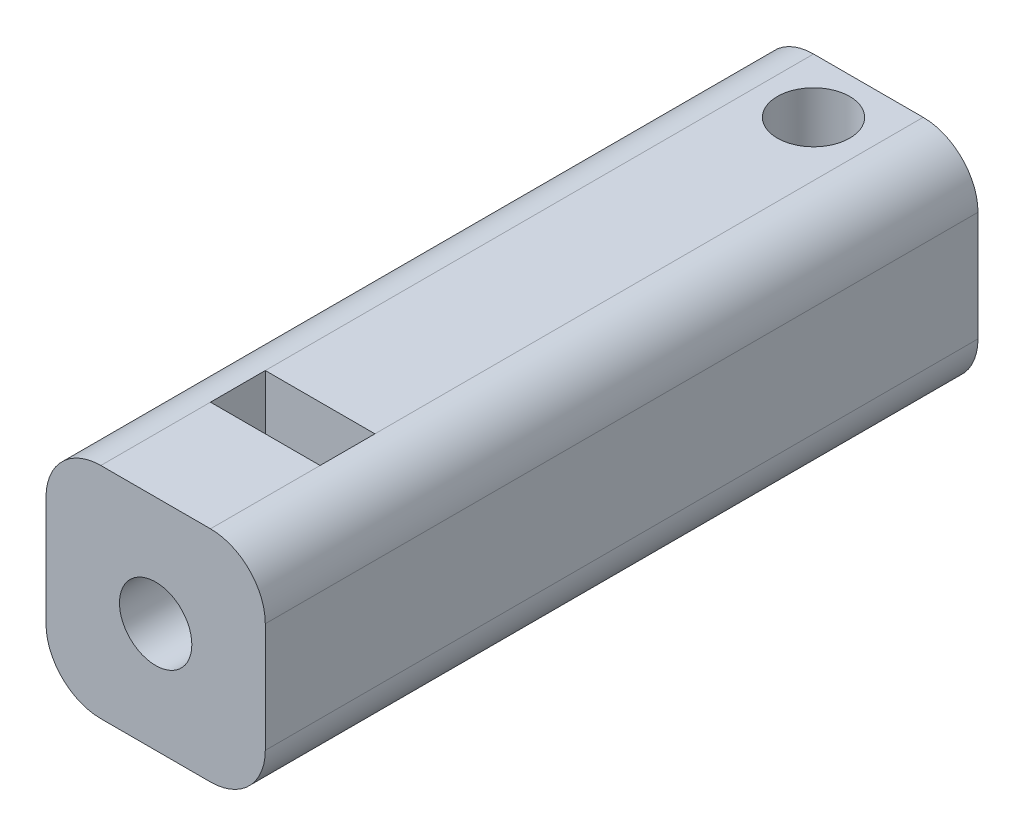
from build123d import *

# Parameters (mm, degrees)
ESBO_O2_W                = 20
ESBO_O2_H                = 20
RESSALTO_EXTRUS_O1_DEPTH = 65
ESBO_O3_R                = 3.3
CORTE_EXTRUS_O1_DEPTH    = 67.520673478
ESBO_O4_R                = 3.3
CORTE_EXTRUS_O2_DEPTH    = 69.738635424
FILETE1_R                = 5
FILETE2_R                = 5
FILETE3_R                = 5
FILETE4_R                = 5
ESBO_O7_W                = 10
ESBO_O7_H                = 5
CORTE_EXTRUS_O3_DEPTH    = 69.738635424


with BuildPart() as part:
    # Esboço2 → Ressalto-extrusão1 (new body)
    with BuildSketch(Plane.XY):
        Rectangle(ESBO_O2_W, ESBO_O2_H)
    extrude(amount=RESSALTO_EXTRUS_O1_DEPTH)

    # Esboço3 → Corte-extrusão1 (cut, through all)
    with BuildSketch(Plane.XY.offset(65)):
        Circle(ESBO_O3_R)
    extrude(amount=-CORTE_EXTRUS_O1_DEPTH, mode=Mode.SUBTRACT)

    # Esboço4 → Corte-extrusão2 (cut, through all)
    with BuildSketch(Plane(origin=(0, -10, 0), x_dir=(-1, 0, 0), z_dir=(0, -1, 0))):
        with Locations(Location((0, -5, 0), (0, 0, 90))):
            Circle(ESBO_O4_R)
    extrude(amount=-CORTE_EXTRUS_O2_DEPTH, mode=Mode.SUBTRACT)

    # Filete1
    filete1_edges = [part.edges().sort_by_distance(p)[0] for p in [
        (10, -10, 32.5),
    ]]
    fillet(filete1_edges, radius=FILETE1_R)

    # Filete2
    filete2_edges = [part.edges().sort_by_distance(p)[0] for p in [
        (10, 10, 32.5),
    ]]
    fillet(filete2_edges, radius=FILETE2_R)

    # Filete3
    filete3_edges = [part.edges().sort_by_distance(p)[0] for p in [
        (-10, 10, 32.5),
    ]]
    fillet(filete3_edges, radius=FILETE3_R)

    # Filete4
    filete4_edges = [part.edges().sort_by_distance(p)[0] for p in [
        (-10, -10, 32.5),
    ]]
    fillet(filete4_edges, radius=FILETE4_R)

    # Esboço7 → Corte-extrusão3 (cut, through all)
    with BuildSketch(Plane(origin=(0, -10, 0), x_dir=(-1, 0, 0), z_dir=(0, -1, 0))):
        with Locations((0, -52.5)):
            Rectangle(ESBO_O7_W, ESBO_O7_H)
    extrude(amount=-CORTE_EXTRUS_O3_DEPTH, mode=Mode.SUBTRACT)


solid = part.part
